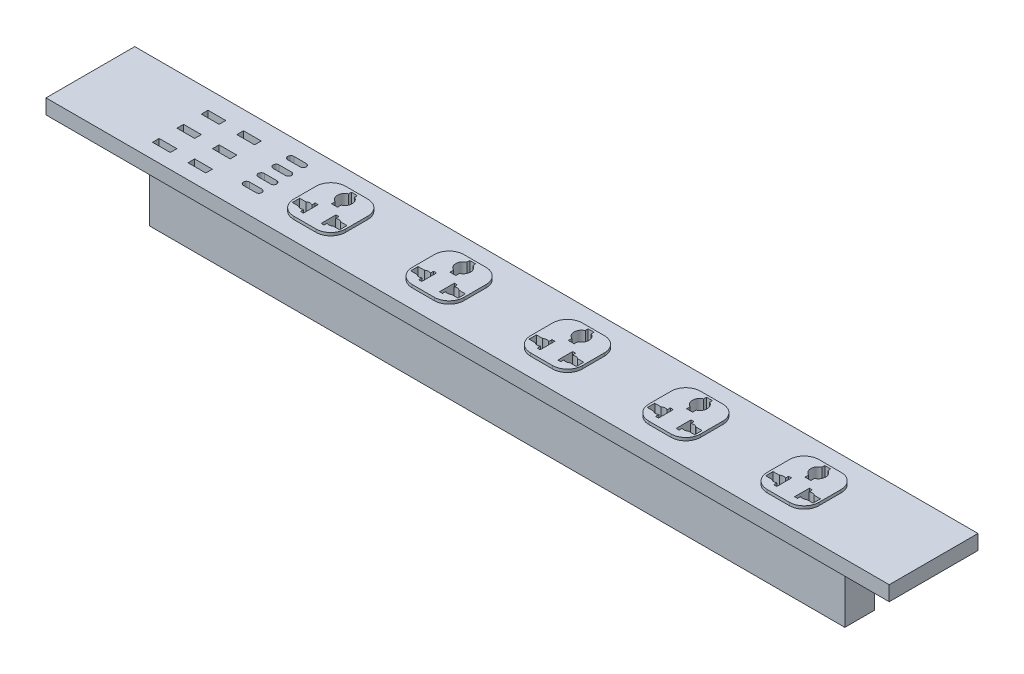
from build123d import *

# Parameters (mm, degrees)
SKETCH1_W              = 470
SKETCH1_H              = 60
BOSS_EXTRUDE1_DEPTH    = 10
SKETCH2_W              = 470
SKETCH2_H              = 20
BOSS_EXTRUDE2_DEPTH    = 50
SKETCH3_W              = 35
SKETCH3_H              = 35
BOSS_EXTRUDE3_DEPTH    = 2
FILLET1_R              = 10
CUT_EXTRUDE1_DEPTH     = 10
LPATTERN1_COUNT        = 5
LPATTERN1_PITCH        = 80
FILLET1_OF_LPATTERN1_R = 10
SKETCH7_W              = 12
SKETCH7_H              = 4.5
CUT_EXTRUDE2_DEPTH     = 10
BOSS_EXTRUDE4_DEPTH    = 50
SKETCH9_W              = 60
SKETCH9_H              = 10
BOSS_EXTRUDE5_DEPTH    = 50


with BuildPart() as part:
    # Sketch1 → Boss-Extrude1 (new body)
    with BuildSketch(Plane(origin=(0, 0, 0), x_dir=(1, 0, 0), z_dir=(0, 1, 0))):
        Rectangle(SKETCH1_W, SKETCH1_H)
    extrude(amount=BOSS_EXTRUDE1_DEPTH)

    # Sketch2 → Boss-Extrude2 (add)
    with BuildSketch(Plane.XZ):
        Rectangle(SKETCH2_W, SKETCH2_H)
    extrude(amount=BOSS_EXTRUDE2_DEPTH)

    # Sketch3 → Boss-Extrude3 (add)
    with BuildSketch(Plane(origin=(0, 10, 0), x_dir=(1, 0, 0), z_dir=(0, 1, 0))):
        with Locations((197.5, 0)):
            Rectangle(SKETCH3_W, SKETCH3_H)
    boss_extrude3 = extrude(amount=BOSS_EXTRUDE3_DEPTH)

    # Fillet1
    fillet1_edges = [part.edges().sort_by_distance(p)[0] for p in [
        (215, 11, 17.5),
        (215, 11, -17.5),
        (180, 11, -17.5),
        (180, 11, 17.5),
    ]]
    fillet(fillet1_edges, radius=FILLET1_R)

    # Sketch5 → Cut-Extrude1 (cut)
    with BuildSketch(Plane(origin=(0, 12, 0), x_dir=(1, 0, 0), z_dir=(0, 1, 0))):
        with BuildLine():
            Line((203.5, -2.5), (205.5, -2.5))
            Line((205.5, -2.5), (205.5, -4.698160912))
            ThreePointArc((205.5, -4.698160912), (207.409467216, -4.26062577), (209.223531105, -5))
            Line((209.223531105, -5), (213.5, -5))
            Line((213.5, -5), (213.5, -10))
            Line((213.5, -10), (209.223531105, -10))
            ThreePointArc((209.223531105, -10), (207.409467216, -10.73937423), (205.5, -10.301839088))
            Line((205.5, -10.301839088), (205.5, -12.5))
            Line((205.5, -12.5), (203.5, -12.5))
            Line((203.5, -12.5), (203.5, -2.5))
        make_face()
        with BuildLine():
            Line((189.5, -2.5), (189.5, -4.698160912))
            ThreePointArc((189.5, -4.698160912), (187.590532784, -4.26062577), (185.776468895, -5))
            Line((185.776468895, -5), (181.5, -5))
            Line((181.5, -5), (181.5, -10))
            Line((181.5, -10), (185.776468895, -10))
            ThreePointArc((185.776468895, -10), (187.590532784, -10.73937423), (189.5, -10.301839088))
            Line((189.5, -10.301839088), (189.5, -12.5))
            Line((189.5, -12.5), (191.5, -12.5))
            Line((191.5, -12.5), (191.5, -2.5))
            Line((191.5, -2.5), (189.5, -2.5))
        make_face()
        with BuildLine():
            Line((195.527489574, 4.905524772), (195.527489574, 2.5))
            Line((195.527489574, 2.5), (199.527489574, 2.5))
            Line((199.527489574, 2.5), (199.527489574, 4.929520153))
            ThreePointArc((199.527489574, 4.929520153), (202.499901679, 9.531356069), (199.470006313, 14.095549491))
            Line((199.470006313, 14.095549491), (199.470006313, 15.999910037))
            Line((199.470006313, 15.999910037), (195.470006313, 15.999910037))
            Line((195.470006313, 15.999910037), (195.470006313, 14.069368187))
            ThreePointArc((195.470006313, 14.069368187), (192.500098368, 9.468636452), (195.527489574, 4.905524772))
        make_face()
    cut_extrude1 = extrude(amount=-CUT_EXTRUDE1_DEPTH, mode=Mode.SUBTRACT)

    # LPattern1: Boss-Extrude3, Cut-Extrude1 ×5
    with Locations(*[(-i * LPATTERN1_PITCH, 0, 0) for i in range(1, LPATTERN1_COUNT)]):
        add(boss_extrude3)
        add(cut_extrude1, mode=Mode.SUBTRACT)

    # Fillet1 of LPattern1
    fillet1_of_lpattern1_edges = [part.edges().sort_by_distance(p)[0] for p in [
        (135, 11, 17.5),
        (135, 11, -17.5),
        (100, 11, -17.5),
        (100, 11, 17.5),
        (55, 11, 17.5),
        (55, 11, -17.5),
        (20, 11, -17.5),
        (20, 11, 17.5),
        (-25, 11, 17.5),
        (-25, 11, -17.5),
        (-60, 11, -17.5),
        (-60, 11, 17.5),
        (-105, 11, 17.5),
        (-105, 11, -17.5),
        (-140, 11, -17.5),
        (-140, 11, 17.5),
    ]]
    fillet(fillet1_of_lpattern1_edges, radius=FILLET1_OF_LPATTERN1_R)

    # Sketch7 → Cut-Extrude2 (cut)
    with BuildSketch(Plane(origin=(0, 10, 0), x_dir=(1, 0, 0), z_dir=(0, 1, 0))):
        with Locations((-217, 15.25)):
            Rectangle(SKETCH7_W, SKETCH7_H)
        with Locations((-217, -1.25)):
            Rectangle(SKETCH7_W, SKETCH7_H)
        with Locations((-217, -17.75)):
            Rectangle(SKETCH7_W, SKETCH7_H)
        with Locations((-193, 15.25)):
            Rectangle(SKETCH7_W, SKETCH7_H)
        with Locations((-193, -1.25)):
            Rectangle(SKETCH7_W, SKETCH7_H)
        with Locations((-193, -17.75)):
            Rectangle(SKETCH7_W, SKETCH7_H)
        with BuildLine():
            Line((-167, 19.537656864), (-158.6, 19.537656864))
            ThreePointArc((-158.6, 19.537656864), (-156.562343136, 17.5), (-158.6, 15.462343136))
            Line((-158.6, 15.462343136), (-167, 15.462343136))
            ThreePointArc((-167, 15.462343136), (-169.037656864, 17.5), (-167, 19.537656864))
        make_face()
        with BuildLine():
            Line((-167, 9.537656864), (-158.6, 9.537656864))
            ThreePointArc((-158.6, 9.537656864), (-156.562343136, 7.5), (-158.6, 5.462343136))
            Line((-158.6, 5.462343136), (-167, 5.462343136))
            ThreePointArc((-167, 5.462343136), (-169.037656864, 7.5), (-167, 9.537656864))
        make_face()
        with BuildLine():
            Line((-167, -0.462343136), (-158.6, -0.462343136))
            ThreePointArc((-158.6, -0.462343136), (-156.562343136, -2.5), (-158.6, -4.537656864))
            Line((-158.6, -4.537656864), (-167, -4.537656864))
            ThreePointArc((-167, -4.537656864), (-169.037656864, -2.5), (-167, -0.462343136))
        make_face()
        with BuildLine():
            Line((-167, -10.462343136), (-158.6, -10.462343136))
            ThreePointArc((-158.6, -10.462343136), (-156.562343136, -12.5), (-158.6, -14.537656864))
            Line((-158.6, -14.537656864), (-167, -14.537656864))
            ThreePointArc((-167, -14.537656864), (-169.037656864, -12.5), (-167, -10.462343136))
        make_face()
    extrude(amount=-CUT_EXTRUDE2_DEPTH, mode=Mode.SUBTRACT)

    # Sketch8 → Boss-Extrude4 (add)
    with BuildSketch(Plane(origin=(235, 0, 0), x_dir=(0, 0, -1), z_dir=(1, 0, 0))):
        Polygon((-30, 10), (-30, 0), (-10, 0), (10, 0), (30, 0), (30, 10), align=None)
    extrude(amount=BOSS_EXTRUDE4_DEPTH)

    # Sketch9 → Boss-Extrude5 (add)
    with BuildSketch(Plane.ZY.offset(235)):
        with Locations((0, 5)):
            Rectangle(SKETCH9_W, SKETCH9_H)
    extrude(amount=BOSS_EXTRUDE5_DEPTH)


solid = part.part
